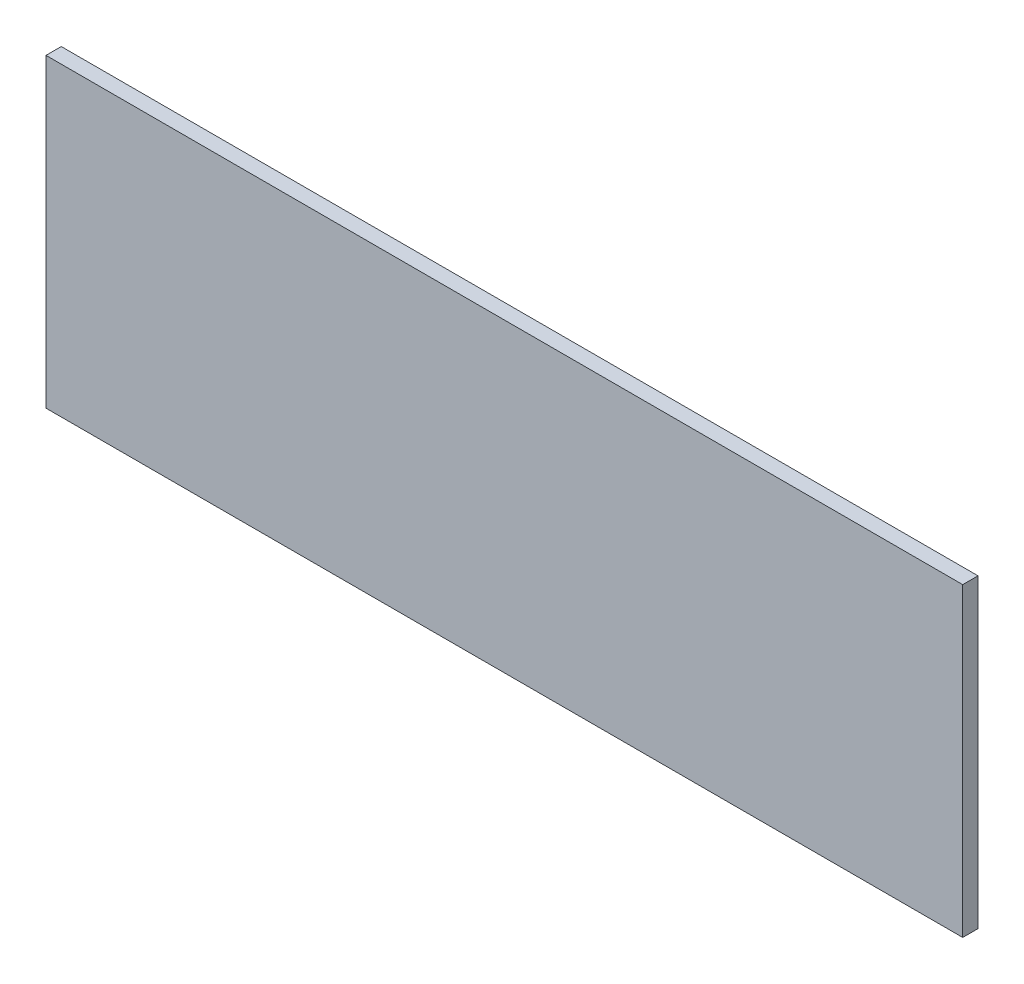
from build123d import *

# Parameters (mm, degrees)
BOSS_EXTRUDE1_DEPTH = 10


with BuildPart() as part:
    # Sketch1 → Boss-Extrude1 (new body)
    with BuildSketch(Plane.XY):
        Polygon((-200, 100), (200, 100), (400, 100), (400, -100), (200, -100), (-200, -100), align=None)
    extrude(amount=BOSS_EXTRUDE1_DEPTH)


solid = part.part
